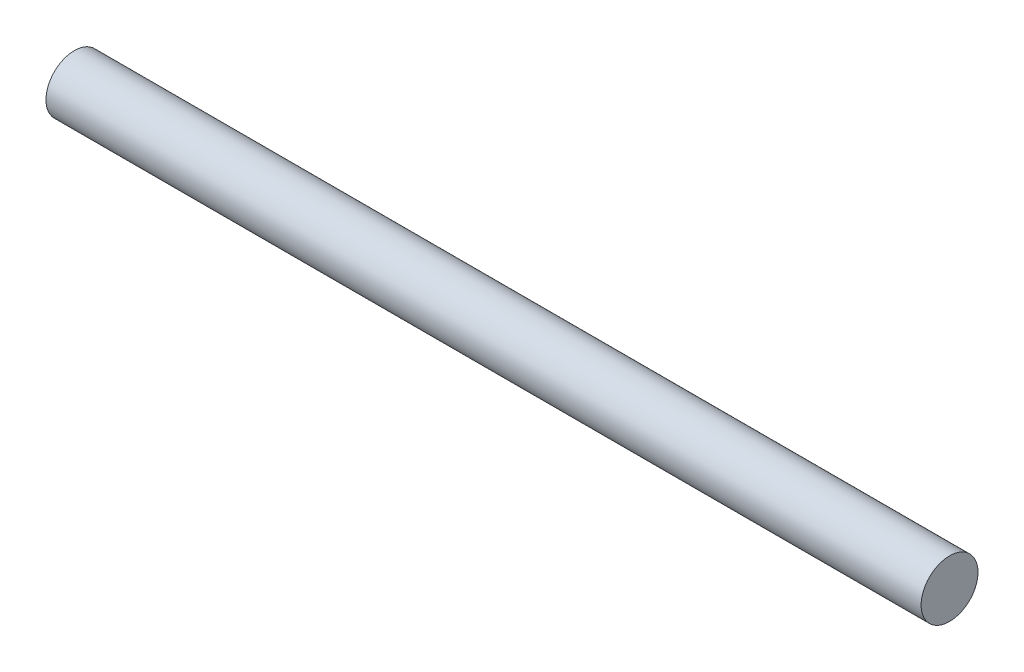
from build123d import *

# Parameters (mm, degrees)
SKETCH1_R           = 6.5
BOSS_EXTRUDE1_DEPTH = 200


with BuildPart() as part:
    # Sketch1 → Boss-Extrude1 (new body)
    with BuildSketch(Plane(origin=(0, 0, 0), x_dir=(0, 0, -1), z_dir=(1, 0, 0))):
        Circle(SKETCH1_R)
    extrude(amount=BOSS_EXTRUDE1_DEPTH)


solid = part.part
